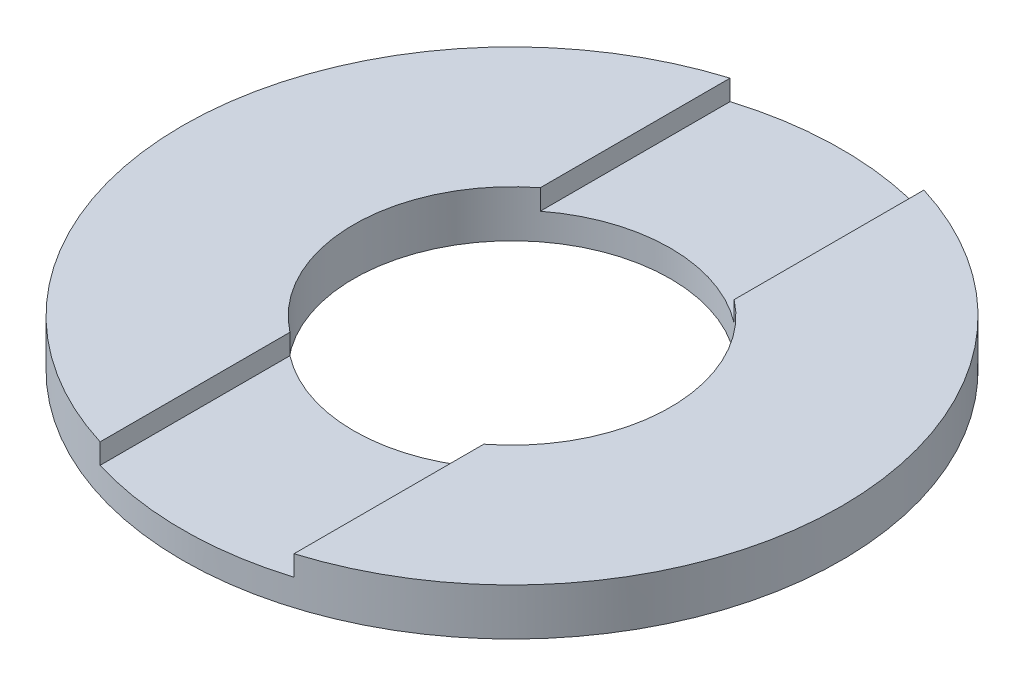
from build123d import *

# Parameters (mm, degrees)
IZIM1_R                     = 40.8
Y_KSEKLIK_EKSTR_ZYON1_DEPTH = 2.9
KES_EKSTR_ZYON1_DEPTH       = 16
KES_EKSTR_ZYON1_DEPTH_BACK  = 7.9
IZIM2_R                     = 9.8
KES_EKSTR_ZYON2_DEPTH       = 1.26
KES_EKSTR_ZYON3_DEPTH       = 21
KES_EKSTR_ZYON3_DEPTH_BACK  = 18.26
IZIM4_R                     = 40.8
IZIM4_R_2                   = 20.4


with BuildPart() as part:
    # Çizim1 → Yükseklik-Ekstrüzyon1 (new body)
    with BuildSketch(Plane(origin=(0, 0, 0), x_dir=(1, 0, 0), z_dir=(0, 1, 0))):
        with Locations(Location((0, 0, 0), (0, 0, 270))):
            Circle(IZIM1_R)
    extrude(amount=Y_KSEKLIK_EKSTR_ZYON1_DEPTH)

    # Çizim2 → Kes-Ekstrüzyon1 (cut, two sides: drawn at the far end of the back side and taken through both)
    with BuildSketch(Plane(origin=(0, 2.9, 0), x_dir=(1, 0, 0), z_dir=(0, 1, 0)).offset(-KES_EKSTR_ZYON1_DEPTH_BACK)):
        with Locations(Location((0, 0, 0), (0, 0, 270))):
            Circle(IZIM2_R)
    extrude(amount=KES_EKSTR_ZYON1_DEPTH + KES_EKSTR_ZYON1_DEPTH_BACK, mode=Mode.SUBTRACT)

    # Çizim3 → Kes-Ekstrüzyon2 (cut)
    with BuildSketch(Plane(origin=(0, 2.9, 0), x_dir=(1, 0, 0), z_dir=(0, 1, 0))):
        Polygon((6, 0), (6, 43.137439927), (-6, 43.137439927), (-6, 0), (-6, -43.926883272), (6, -43.926883272), align=None)
    extrude(amount=-KES_EKSTR_ZYON2_DEPTH, mode=Mode.SUBTRACT)

    # Çizim4 → Kes-Ekstrüzyon3 (cut, two sides: drawn at the far end of the back side and taken through both)
    with BuildSketch(Plane(origin=(0, 2.9, 0), x_dir=(1, 0, 0), z_dir=(0, 1, 0)).offset(-KES_EKSTR_ZYON3_DEPTH_BACK)):
        Circle(IZIM4_R)
        with Locations(Location((0, 0, 0), (0, 0, 72.895364823))):
            Circle(IZIM4_R_2, mode=Mode.SUBTRACT)
    extrude(amount=KES_EKSTR_ZYON3_DEPTH + KES_EKSTR_ZYON3_DEPTH_BACK, mode=Mode.SUBTRACT)


solid = part.part
